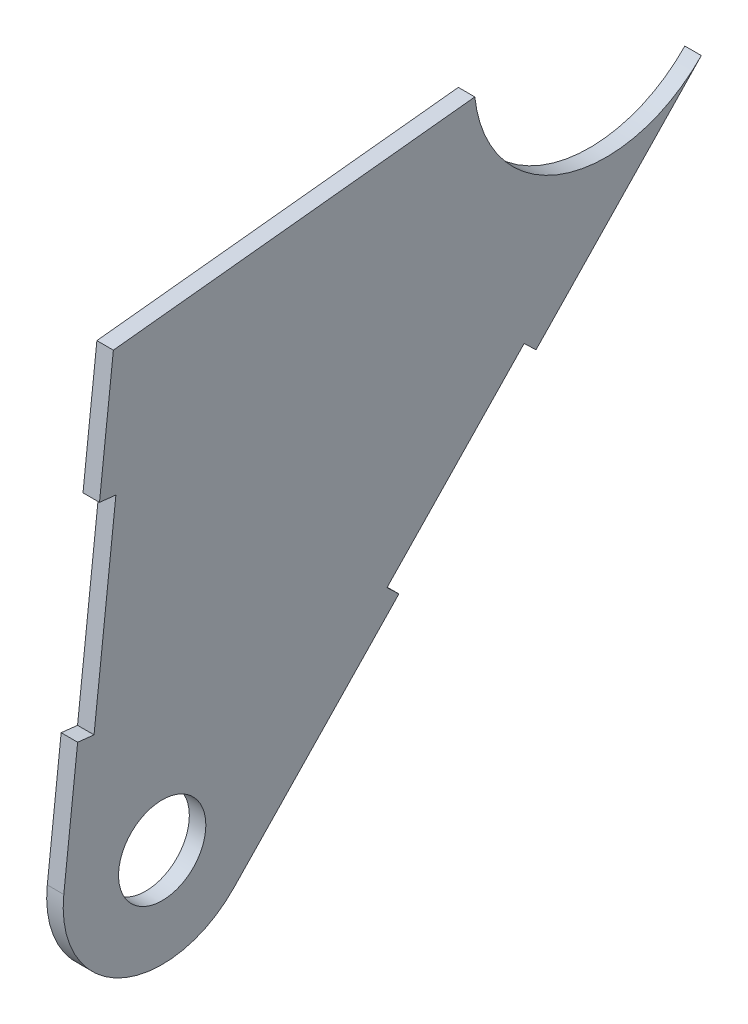
from build123d import *

# Parameters (mm, degrees)
BOSS_EXTRUDE1_DEPTH  = 1.5875
M8_CLEARANCE_HOLE1_D = 8.4


with BuildPart() as part:
    # Sketch1 → Boss-Extrude1 (new body)
    with BuildSketch(Plane(origin=(0, 0, 0), x_dir=(0, 0, -1), z_dir=(1, 0, 0))):
        with BuildLine():
            Line((-9.466844547, 1.05094211), (-8.132830894, 13.067683806))
            Line((-8.132830894, 13.067683806), (-6.55502347, 12.892526787))
            Line((-6.55502347, 12.892526787), (-4.453139249, 31.826215882))
            Line((-4.453139249, 31.826215882), (-6.030946674, 32.0013729))
            Line((-6.030946674, 32.0013729), (-4.696933021, 44.018114595))
            Line((-4.696933021, 44.018114595), (30.078862848, 47.728850174))
            ThreePointArc((30.078862848, 47.728850174), (38.60002065, 37.058807525), (51.869269545, 40.281690423))
            Line((51.869269545, 40.281690423), (35.966414021, 23.714419941))
            Line((35.966414021, 23.714419941), (34.821152107, 24.813752193))
            Line((34.821152107, 24.813752193), (21.629165093, 11.070609225))
            Line((21.629165093, 11.070609225), (22.774427007, 9.971276974))
            Line((22.774427007, 9.971276974), (6.871571484, -6.595993507))
            ThreePointArc((6.871571484, -6.595993507), (-4.037668467, -8.626868397), (-9.466844547, 1.05094211))
        make_face()
    extrude(amount=BOSS_EXTRUDE1_DEPTH)

    # M8 Clearance Hole1 (through all)
    with Locations(Plane(origin=(1.5875, 0, 0), x_dir=(0, 0, -1), z_dir=(1, 0, 0))):
        with Locations((0, 0)):
            Hole(M8_CLEARANCE_HOLE1_D / 2)


solid = part.part
